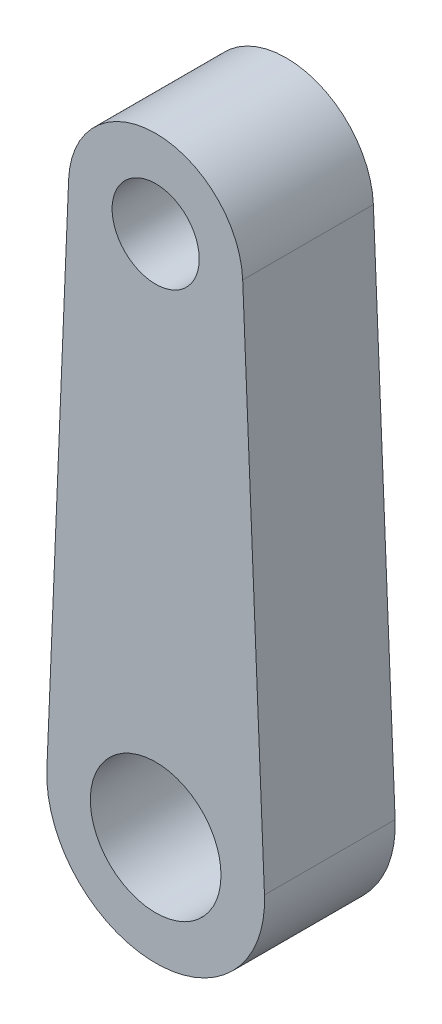
from build123d import *

# Parameters (mm, degrees)
SKETCH1_R           = 1
SKETCH1_R_2         = 1.5
BOSS_EXTRUDE1_DEPTH = 3


with BuildPart() as part:
    # Sketch1 → Boss-Extrude1 (new body)
    with BuildSketch(Plane.XY):
        with BuildLine():
            Line((1.998263135, 6.083333333), (2.497828918, -5.895833333))
            ThreePointArc((2.497828918, -5.895833333), (0, -8.5), (-2.497828918, -5.895833333))
            Line((-2.497828918, -5.895833333), (-1.998263135, 6.083333333))
            ThreePointArc((-1.998263135, 6.083333333), (0, 8), (1.998263135, 6.083333333))
        make_face()
        with Locations((0, 6)):
            Circle(SKETCH1_R, mode=Mode.SUBTRACT)
        with Locations((0, -6)):
            Circle(SKETCH1_R_2, mode=Mode.SUBTRACT)
    extrude(amount=BOSS_EXTRUDE1_DEPTH)


solid = part.part
